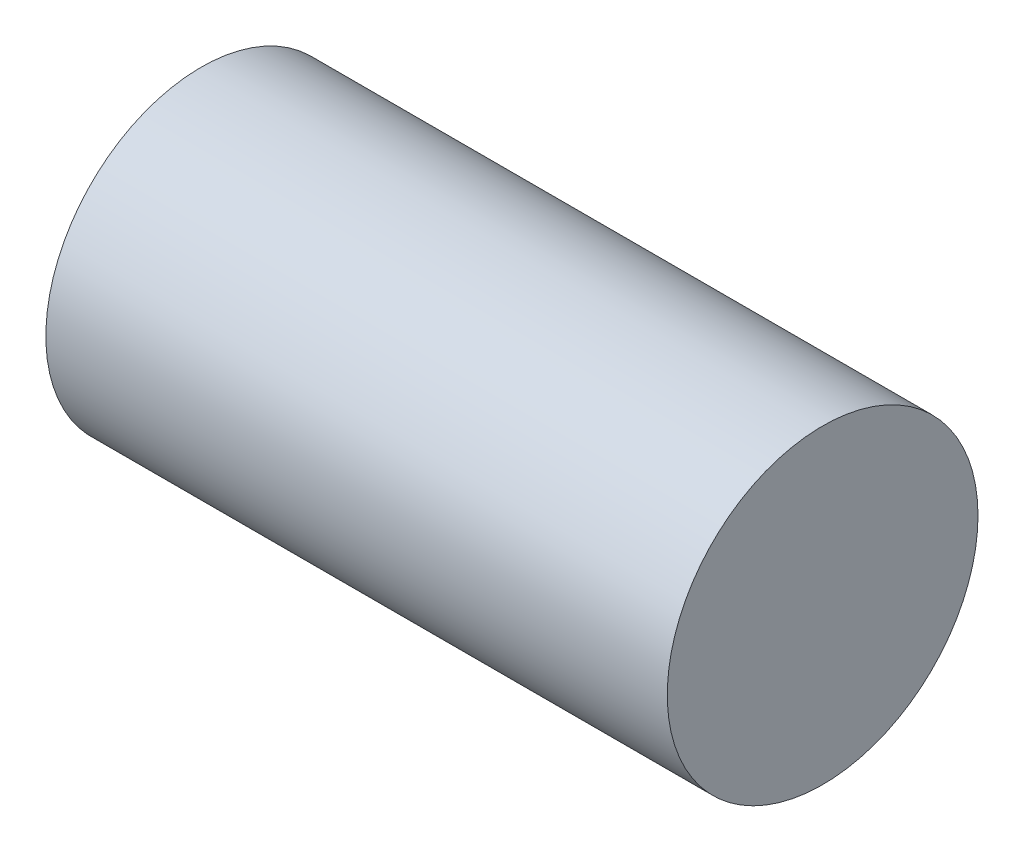
from build123d import *

# Parameters (mm, degrees)
SKETCH1_R           = 6.35
BOSS_EXTRUDE1_DEPTH = 25.4


with BuildPart() as part:
    # Sketch1 → Boss-Extrude1 (new body)
    with BuildSketch(Plane(origin=(0, 0, 0), x_dir=(0, 0, -1), z_dir=(1, 0, 0))):
        Circle(SKETCH1_R)
    extrude(amount=BOSS_EXTRUDE1_DEPTH)


solid = part.part
